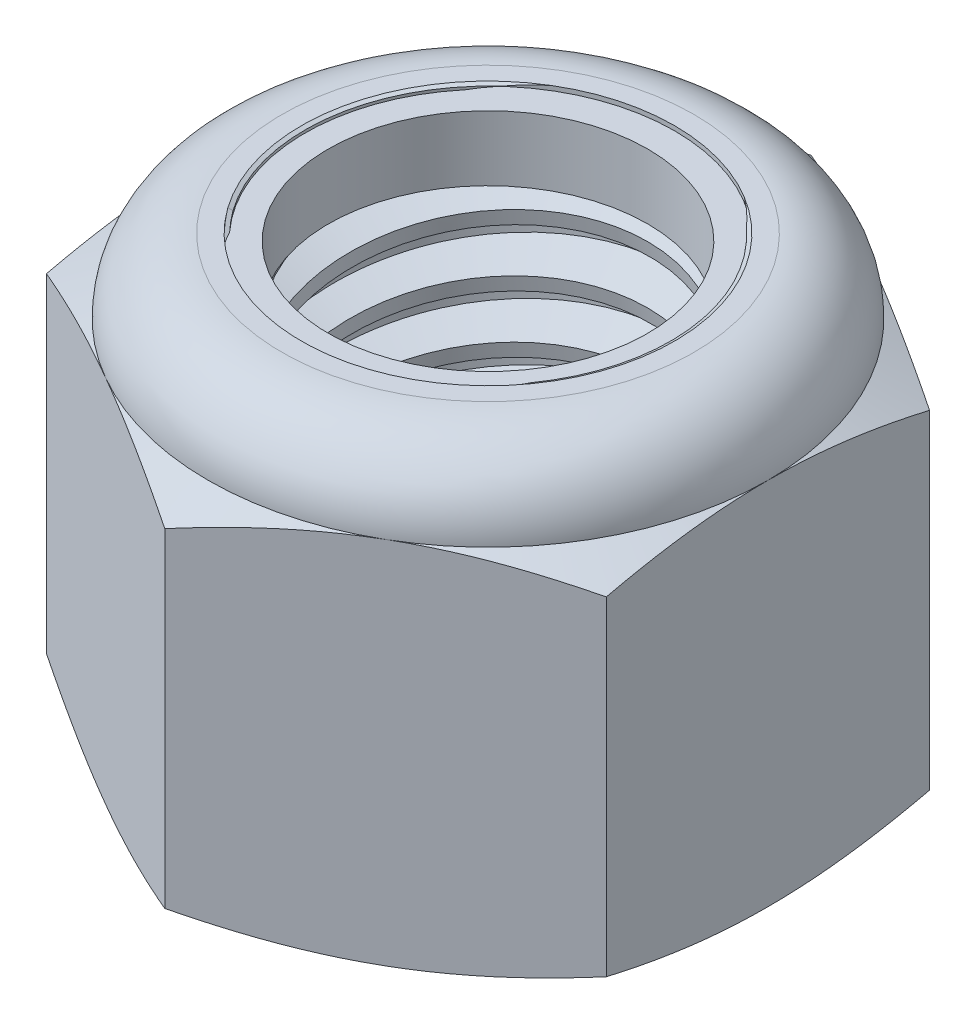
from build123d import *

# Parameters (mm, degrees)
EXTRUDE1_DEPTH      = 15.08125
SKETCH2_W           = 6.35
SKETCH2_H           = 15.08125
LPATTERN1_COUNT     = 8
LPATTERN1_PITCH     = 1.953846154
LPATTERN1_COL_COUNT = 2
LPATTERN1_COL_PITCH = 1.953846154


with BuildPart() as part:
    # Sketch1 → Extrude1 (new body)
    with BuildSketch(Plane(origin=(0, 0, 0), x_dir=(1, 0, 0), z_dir=(0, 1, 0))):
        Polygon((0, 10.998522628), (-9.525, 5.499261314), (-9.525, -5.499261314), (0, -10.998522628), (9.525, -5.499261314), (9.525, 5.499261314), align=None)
    extrude(amount=EXTRUDE1_DEPTH)

    # Sketch4 → Cut-Revolve2 (revolve, cut)
    with BuildSketch(Plane(origin=(0, 0, 0), x_dir=(0, 0, -1), z_dir=(1, 0, 0)), mode=Mode.PRIVATE) as cut_revolve2_sk:
        Polygon((0, 15.08125), (6.35, 15.08125), (5.434726912, 14.65445115), (5.434726912, 0.42679885), (6.35, 0), (0, 0), align=None)
    revolve(cut_revolve2_sk.sketch.rotate(Axis((0, 15.08125, 0), (0, 1, 0)), 55.034193324), axis=Axis((0, 15.08125, 0), (0, 1, 0)), mode=Mode.SUBTRACT)


with BuildPart() as body_2:
    # Sketch2 → Revolve1 (revolve)
    with BuildSketch(Plane(origin=(0, 0, 0), x_dir=(0, 0, -1), z_dir=(1, 0, 0))):
        with Locations((3.175, 7.540625)):
            Rectangle(SKETCH2_W, SKETCH2_H)
    revolve(axis=Axis((0, -6.35, 0), (0, 1, 0)))

    # Sketch3 → Cut-Revolve1 (revolve, cut)
    with BuildSketch(Plane(origin=(0, 0, 0), x_dir=(0, 0, -1), z_dir=(1, 0, 0)), mode=Mode.PRIVATE) as cut_revolve1_sk:
        Polygon((6.387137043, 14.83985922), (6.647096345, 13.15012376), (5.509000998, 13.592792596), (5.434726912, 14.075574156), align=None)
    cut_revolve1 = revolve(cut_revolve1_sk.sketch.rotate(Axis((0, 15.08125, 0.321367977), (0, -0.9883716976506172, -0.15205718425394146)), 180), axis=Axis((0, 15.08125, 0.321367977), (0, -0.9883716976506172, -0.15205718425394146)), mode=Mode.SUBTRACT)

    # LPattern1: Cut-Revolve1 ×8
    with Locations(*[(0, -i * LPATTERN1_PITCH, 0) for i in range(1, LPATTERN1_COUNT)]):
        add(cut_revolve1, mode=Mode.SUBTRACT)

    # LPattern1 col: Cut-Revolve1 ×2
    with Locations(*[(0, i * LPATTERN1_COL_PITCH, 0) for i in range(1, LPATTERN1_COL_COUNT)]):
        add(cut_revolve1, mode=Mode.SUBTRACT)


with BuildPart() as part_1:
    add(part.part)

    # Combine1: cut body 2
    add(body_2.part, mode=Mode.SUBTRACT)

    # Sketch5 → Cut-Revolve3 (revolve, cut)
    with BuildSketch(Plane(origin=(0, 0, 0), x_dir=(0, 0, -1), z_dir=(1, 0, 0)), mode=Mode.PRIVATE) as cut_revolve3_sk:
        with BuildLine():
            Line((0, 0), (9.525, 0))
            Line((9.525, 0), (10.998522628, 0.687114886))
            Line((10.998522628, 0.687114886), (10.998522628, 11.880593447))
            Line((10.998522628, 11.880593447), (9.525, 12.567708333))
            ThreePointArc((9.525, 12.567708333), (8.788800691, 14.345050691), (7.011458333, 15.08125))
            Line((7.011458333, 15.08125), (7.011458333, 16.35125))
            Line((7.011458333, 16.35125), (12.268522628, 16.35125))
            Line((12.268522628, 16.35125), (12.268522628, -1.27))
            Line((12.268522628, -1.27), (0, -1.27))
            Line((0, -1.27), (0, 0))
        make_face()
    revolve(cut_revolve3_sk.sketch.rotate(Axis((0, 0, 0), (0, 1, 0)), 55.034193324), axis=Axis((0, 0, 0), (0, 1, 0)), mode=Mode.SUBTRACT)

    # Sketch6 → Cut-Revolve4 (revolve, cut)
    with BuildSketch(Plane(origin=(0, 0, 0), x_dir=(0, 0, -1), z_dir=(1, 0, 0)), mode=Mode.PRIVATE) as cut_revolve4_sk:
        with BuildLine():
            Line((0, 12.567708333), (9.3726, 12.567708333))
            ThreePointArc((9.3726, 12.567708333), (8.681037617, 14.237287617), (7.011458333, 14.92885))
            Line((7.011458333, 14.92885), (6.223092623, 14.92885))
            Line((6.223092623, 14.92885), (6.223092623, 16.35125))
            Line((6.223092623, 16.35125), (0, 16.35125))
            Line((0, 16.35125), (0, 12.567708333))
        make_face()
    revolve(cut_revolve4_sk.sketch.rotate(Axis((0, 16.35125, 0), (0, 1, 0)), 55.034193324), axis=Axis((0, 16.35125, 0), (0, 1, 0)), mode=Mode.SUBTRACT)


with BuildPart() as body_2_2:
    # Sketch7 → Revolve2 (revolve)
    with BuildSketch(Plane(origin=(0, 0, 0), x_dir=(0, 0, -1), z_dir=(1, 0, 0)), mode=Mode.PRIVATE) as revolve2_sk:
        with BuildLine():
            Line((5.434726912, 12.643908333), (9.295129058, 12.643908333))
            ThreePointArc((9.295129058, 12.643908333), (8.599986877, 14.210125907), (7.011458333, 14.85265))
            Line((7.011458333, 14.85265), (5.434726912, 14.85265))
            Line((5.434726912, 14.85265), (5.434726912, 12.643908333))
        make_face()
    revolve(revolve2_sk.sketch.rotate(Axis((0, 12.643908333, 0), (0, 1, 0)), 55.034193324), axis=Axis((0, 12.643908333, 0), (0, 1, 0)))


solid = Compound([part_1.part, body_2_2.part])
